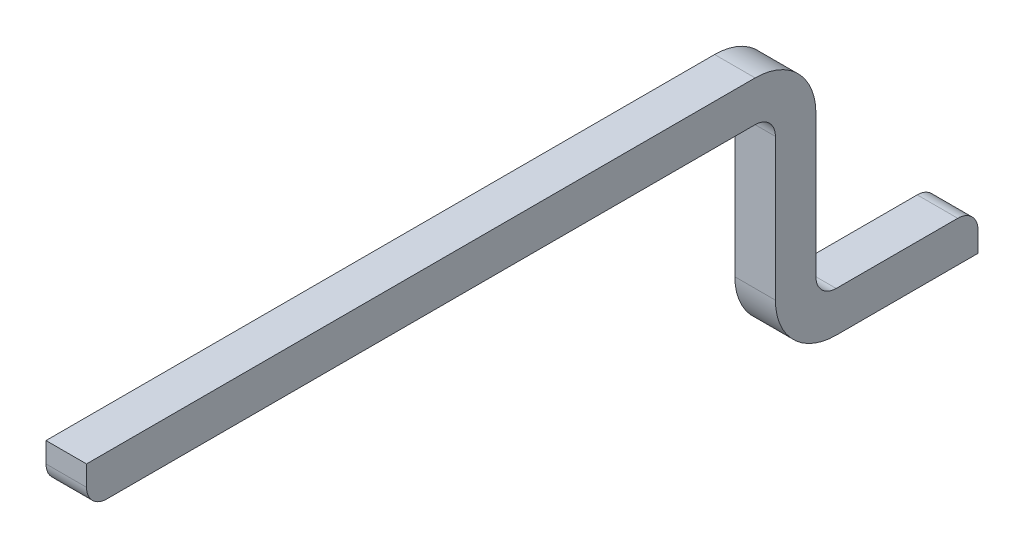
from build123d import *

# Parameters (mm, degrees)
EXTRUDE_THIN1_DEPTH = 0.1
FILLET1_R           = 0.1


with BuildPart() as part:
    # Sketch1 → Extrude-Thin1 (new, symmetric)
    with BuildSketch(Plane(origin=(0, 0, 0), x_dir=(0, 0, -1), z_dir=(1, 0, 0))):
        with BuildLine():
            Line((0.8, 1.1), (4.1, 1.1))
            ThreePointArc((4.1, 1.1), (4.170710678, 1.070710678), (4.2, 1))
            Line((4.2, 1), (4.2, 0.3))
            ThreePointArc((4.2, 0.3), (4.287867966, 0.087867966), (4.5, 0))
            Line((4.5, 0), (5.2, 0))
            Line((5.2, 0), (5.2, 0.2))
            Line((5.2, 0.2), (4.5, 0.2))
            ThreePointArc((4.5, 0.2), (4.429289322, 0.229289322), (4.4, 0.3))
            Line((4.4, 0.3), (4.4, 1))
            ThreePointArc((4.4, 1), (4.312132034, 1.212132034), (4.1, 1.3))
            Line((4.1, 1.3), (0.8, 1.3))
            Line((0.8, 1.3), (0.8, 1.1))
        make_face()
    extrude(amount=EXTRUDE_THIN1_DEPTH, both=True)

    # Fillet1
    fillet1_edges = [part.edges().sort_by_distance(p)[0] for p in [
        (0, 1.1, -0.8),
        (0, 0.2, -5.2),
    ]]
    fillet(fillet1_edges, radius=FILLET1_R)


solid = part.part
